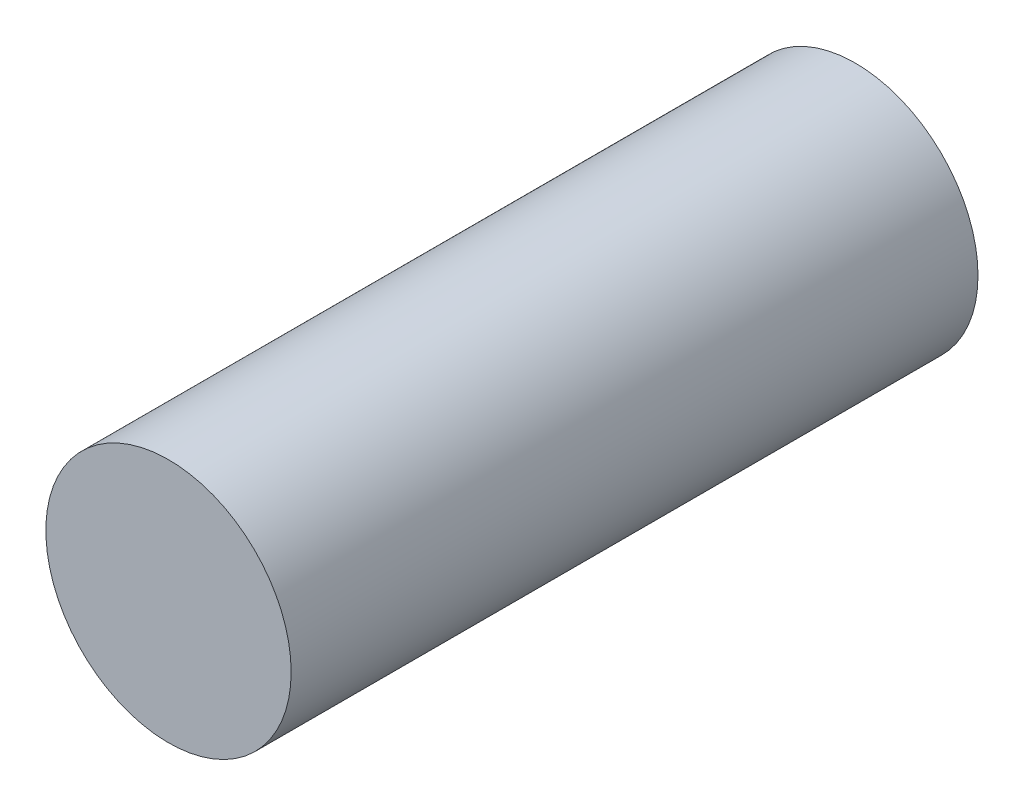
from build123d import *

# Parameters (mm, degrees)
SKETCH_1_R      = 12.5
EXTRUDE_1_DEPTH = 70


with BuildPart() as part:
    # Эскиз1 → Бобышка-Вытянуть1 (new body)
    with BuildSketch(Plane.XY):
        Circle(SKETCH_1_R)
    extrude(amount=EXTRUDE_1_DEPTH)


solid = part.part
